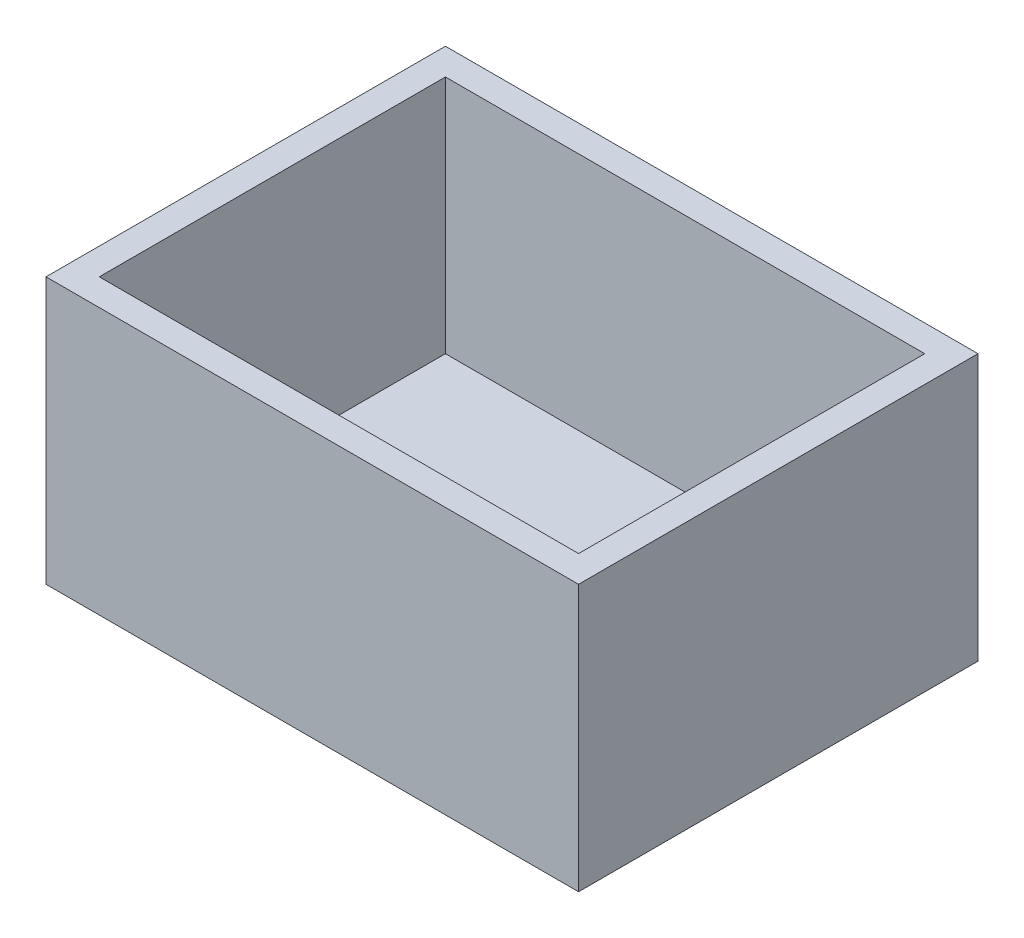
from build123d import *

# Parameters (mm, degrees)
SKETCH1_W           = 40
SKETCH1_H           = 30
BOSS_EXTRUDE1_DEPTH = 20
SHELL1_T            = -2


with BuildPart() as part:
    # Sketch1 → Boss-Extrude1 (new body)
    with BuildSketch(Plane(origin=(0, 0, 0), x_dir=(1, 0, 0), z_dir=(0, 1, 0))):
        Rectangle(SKETCH1_W, SKETCH1_H)
    extrude(amount=BOSS_EXTRUDE1_DEPTH)

    # Shell1
    shell1_openings = [part.faces().sort_by_distance(p)[0] for p in [
        (0, 20, 0),
    ]]
    offset(amount=SHELL1_T, openings=shell1_openings, kind=Kind.INTERSECTION)


solid = part.part
